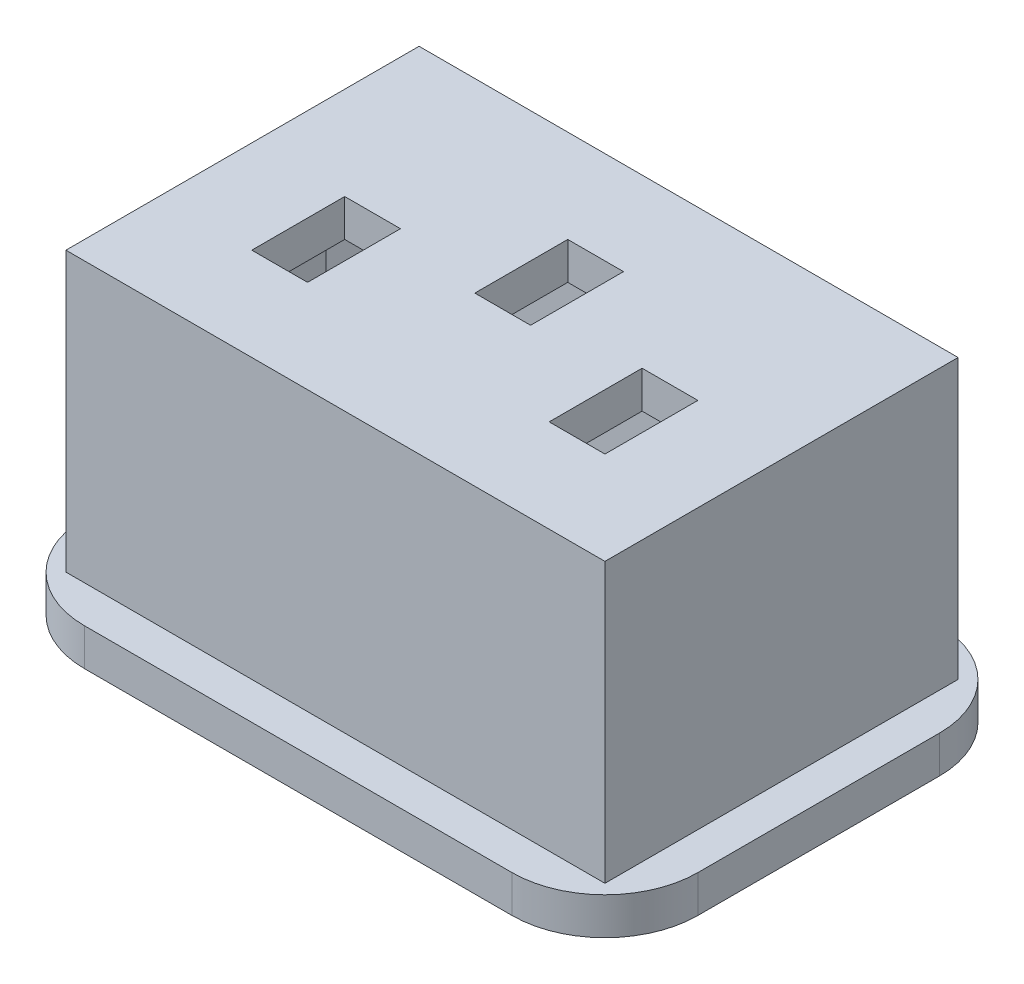
from build123d import *

# Parameters (mm, degrees)
SKETCH2_W           = 29
SKETCH2_H           = 19
BOSS_EXTRUDE1_DEPTH = 15
CUT_EXTRUDE1_DEPTH  = 13
SKETCH4_W           = 3
SKETCH4_H           = 5
CUT_EXTRUDE2_DEPTH  = 13
SKETCH5_W           = 33
SKETCH5_H           = 23
BOSS_EXTRUDE2_DEPTH = 2
FILLET1_R           = 5
FILLET2_R           = 5
FILLET3_R           = 5
FILLET4_R           = 5


with BuildPart() as part:
    # Sketch2 → Boss-Extrude1 (new body)
    with BuildSketch(Plane(origin=(0, 0, 0), x_dir=(1, 0, 0), z_dir=(0, 1, 0))):
        with Locations((12.5, 7.5)):
            Rectangle(SKETCH2_W, SKETCH2_H)
    extrude(amount=BOSS_EXTRUDE1_DEPTH)

    # Sketch3 → Cut-Extrude1 (cut)
    with BuildSketch(Plane.XZ):
        Polygon((0, 0), (0, -10), (5, -15), (20, -15), (25, -10), (25, 0), align=None)
    extrude(amount=-CUT_EXTRUDE1_DEPTH, mode=Mode.SUBTRACT)

    # Sketch4 → Cut-Extrude2 (cut)
    with BuildSketch(Plane.XZ.offset(-13)):
        with Locations((4.5, -5.5)):
            Rectangle(SKETCH4_W, SKETCH4_H)
        with Locations((12.5, -9.5)):
            Rectangle(SKETCH4_W, SKETCH4_H)
        with Locations((20.5, -5.5)):
            Rectangle(SKETCH4_W, SKETCH4_H)
    extrude(amount=-CUT_EXTRUDE2_DEPTH, mode=Mode.SUBTRACT)

    # Sketch5 → Boss-Extrude2 (add)
    with BuildSketch(Plane.XZ):
        with Locations((12.5, -7.5)):
            Rectangle(SKETCH5_W, SKETCH5_H)
        Polygon((0, 0), (0, -10), (5, -15), (20, -15), (25, -10), (25, 0), align=None, mode=Mode.SUBTRACT)
    extrude(amount=BOSS_EXTRUDE2_DEPTH)

    # Fillet1
    fillet1_edges = [part.edges().sort_by_distance(p)[0] for p in [
        (29, -1, -19),
    ]]
    fillet(fillet1_edges, radius=FILLET1_R)

    # Fillet2
    fillet2_edges = [part.edges().sort_by_distance(p)[0] for p in [
        (29, -1, 4),
    ]]
    fillet(fillet2_edges, radius=FILLET2_R)

    # Fillet3
    fillet3_edges = [part.edges().sort_by_distance(p)[0] for p in [
        (-4, -1, 4),
    ]]
    fillet(fillet3_edges, radius=FILLET3_R)

    # Fillet4
    fillet4_edges = [part.edges().sort_by_distance(p)[0] for p in [
        (-4, -1, -19),
    ]]
    fillet(fillet4_edges, radius=FILLET4_R)


solid = part.part
